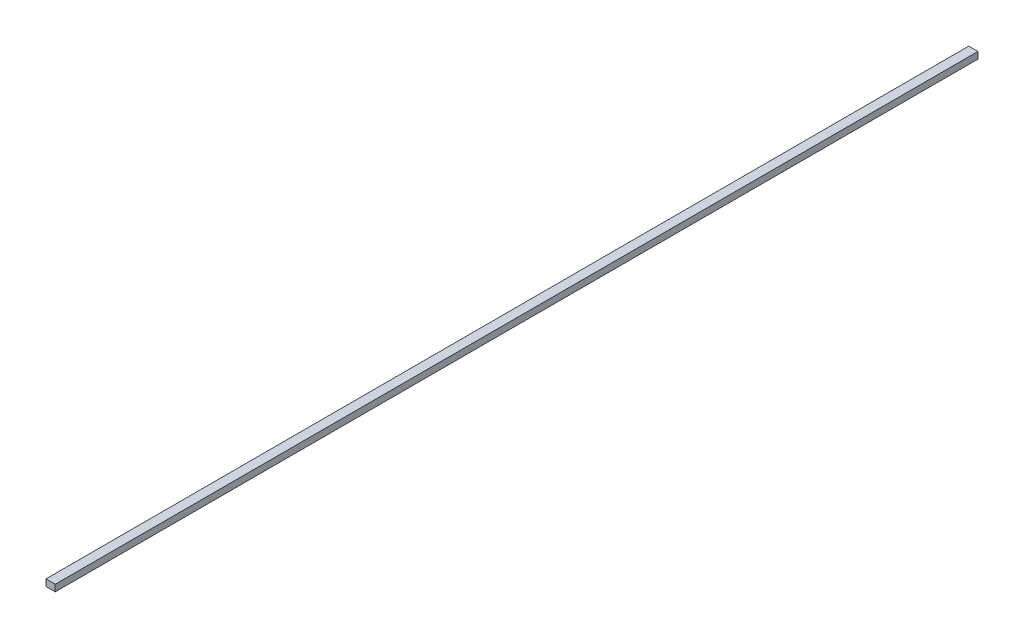
from build123d import *

# Parameters (mm, degrees)
SKETCH2_W           = 5
SKETCH2_H           = 3.6
BOSS_EXTRUDE1_DEPTH = 500


with BuildPart() as part:
    # Sketch2 → Boss-Extrude1 (new body)
    with BuildSketch(Plane.XY):
        with Locations((2.5, 1.8)):
            Rectangle(SKETCH2_W, SKETCH2_H)
    extrude(amount=BOSS_EXTRUDE1_DEPTH)


solid = part.part
